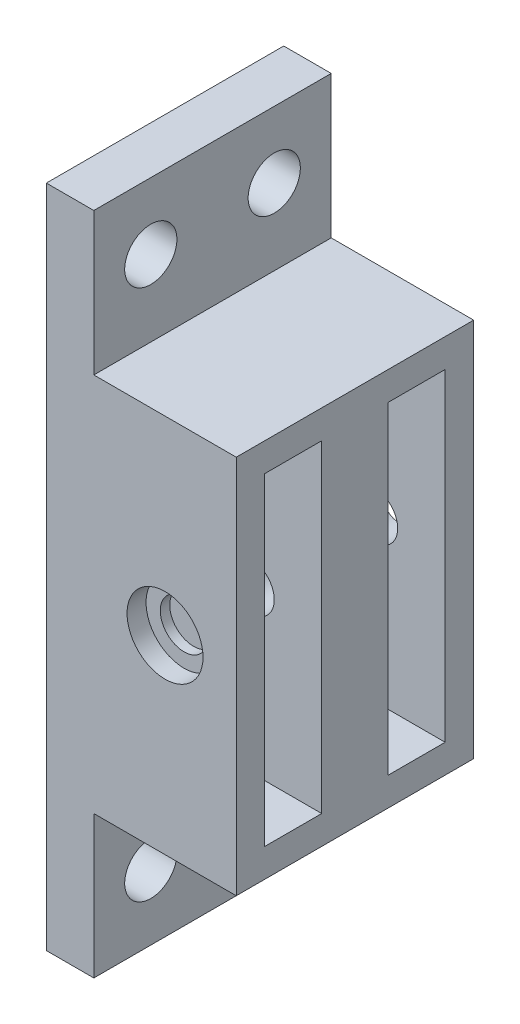
from build123d import *

# Parameters (mm, degrees)
SKICA1_W                 = 25
SKICA1_H                 = 70
SKICA1_R                 = 2.75
P_IDAT_VYSUNUT_M1_DEPTH  = 5
SKICA2_W                 = 25
SKICA2_H                 = 40
P_IDAT_VYSUNUT_M2_DEPTH  = 15
SKICA3_W                 = 6
SKICA3_H                 = 34
ODEBRAT_VYSUNUT_M1_DEPTH = 72.377271817
SKICA4_R                 = 4
ODEBRAT_VYSUNUT_M2_DEPTH = 2
SKICA5_R                 = 2.5
ODEBRAT_VYSUNUT_M3_DEPTH = 60.747879831


with BuildPart() as part:
    # Skica1 → Přidat vysunutím1 (new body)
    with BuildSketch(Plane(origin=(0, 0, 0), x_dir=(0, 0, -1), z_dir=(1, 0, 0))):
        with Locations((32.820037376, 16.388803686)):
            Rectangle(SKICA1_W, SKICA1_H)
        with Locations((26.320037376, 44.388803686)):
            Circle(SKICA1_R, mode=Mode.SUBTRACT)
        with Locations((39.320037376, 44.388803686)):
            Circle(SKICA1_R, mode=Mode.SUBTRACT)
        with Locations((26.320037376, -11.611196314)):
            Circle(SKICA1_R, mode=Mode.SUBTRACT)
        with Locations((39.320037376, -11.611196314)):
            Circle(SKICA1_R, mode=Mode.SUBTRACT)
    extrude(amount=P_IDAT_VYSUNUT_M1_DEPTH)

    # Skica2 → Přidat vysunutím2 (add)
    with BuildSketch(Plane(origin=(5, 0, 0), x_dir=(0, 0, -1), z_dir=(1, 0, 0))):
        with Locations((32.820037376, 16.388803686)):
            Rectangle(SKICA2_W, SKICA2_H)
    extrude(amount=P_IDAT_VYSUNUT_M2_DEPTH)

    # Skica3 → Odebrat vysunutím1 (cut, through all)
    with BuildSketch(Plane(origin=(20, 0, 0), x_dir=(0, 0, -1), z_dir=(1, 0, 0))):
        with Locations((26.320037376, 16.388803686)):
            Rectangle(SKICA3_W, SKICA3_H)
        with Locations((39.320037376, 16.388803686)):
            Rectangle(SKICA3_W, SKICA3_H)
    extrude(amount=-ODEBRAT_VYSUNUT_M1_DEPTH, mode=Mode.SUBTRACT)

    # Skica4 → Odebrat vysunutím2 (cut)
    with BuildSketch(Plane.XY.offset(-20.320037376)):
        with Locations((12.5, 16.388803686)):
            Circle(SKICA4_R)
    extrude(amount=-ODEBRAT_VYSUNUT_M2_DEPTH, mode=Mode.SUBTRACT)

    # Skica5 → Odebrat vysunutím3 (cut, through all)
    with BuildSketch(Plane.XY.offset(-22.320037376)):
        with Locations(Location((12.5, 16.388803686, 0), (0, 0, 90))):
            Circle(SKICA5_R)
    extrude(amount=-ODEBRAT_VYSUNUT_M3_DEPTH, mode=Mode.SUBTRACT)


solid = part.part
